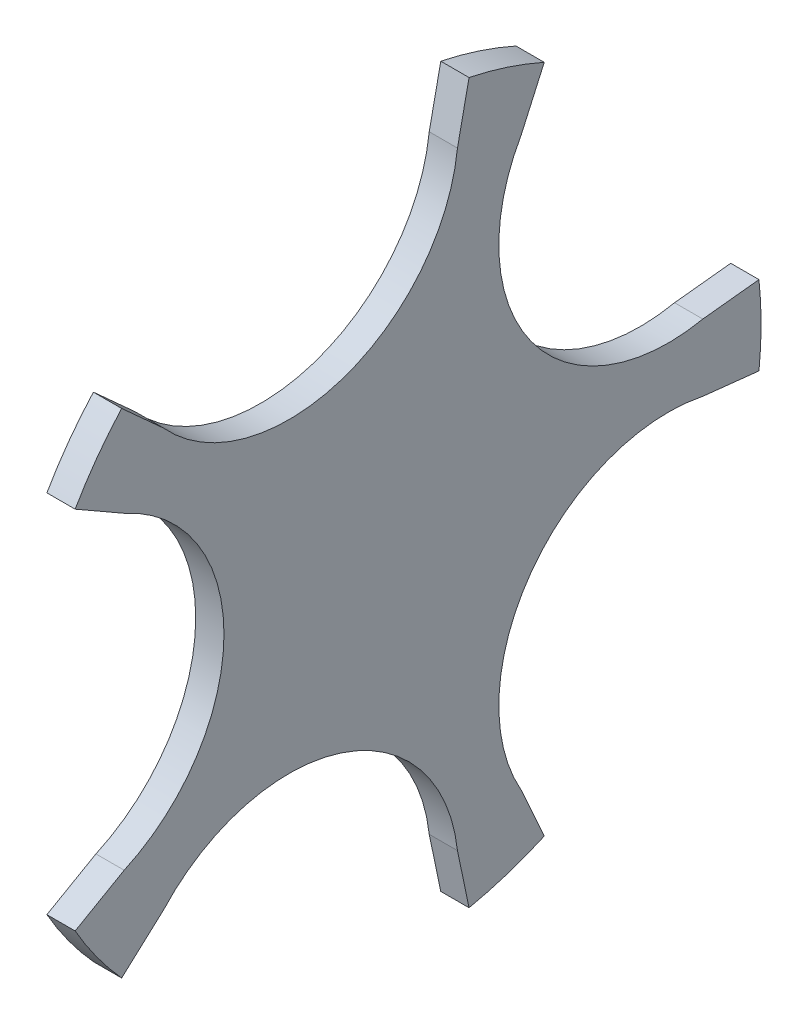
from build123d import *

# Parameters (mm, degrees)
ESTRUSIONE_ESTRUSIONE1_DEPTH = 0.5


with BuildPart() as part:
    # Schizzo1 → Estrusione-Estrusione1 (new body)
    with BuildSketch(Plane(origin=(6.153846154, 0, 0), x_dir=(0, 0, -1), z_dir=(1, 0, 0))):
        with BuildLine():
            Line((-4.816677492, -4.3645868), (-4.075796555, -3.693244539))
            ThreePointArc((-4.075796555, -3.693244539), (-0.928739601, -2.858366579), (1.126554006, -5.383590703))
            Line((1.126554006, -5.383590703), (1.331334195, -6.36219689))
            ThreePointArc((1.331334195, -6.36219689), (2.008610463, -6.181867356), (2.662533515, -5.929664011))
            Line((2.662533515, -5.929664011), (2.252993884, -5.0175882))
            ThreePointArc((2.252993884, -5.0175882), (2.431471841, -1.766567698), (5.468223352, -0.59220449))
            Line((5.468223352, -0.59220449), (6.462213701, -0.699852899))
            ThreePointArc((6.462213701, -0.699852899), (6.5, 0), (6.462213701, 0.699852899))
            Line((6.462213701, 0.699852899), (5.468223352, 0.59220449))
            ThreePointArc((5.468223352, 0.59220449), (2.431471841, 1.766567698), (2.252993884, 5.0175882))
            Line((2.252993884, 5.0175882), (2.662533515, 5.929664011))
            ThreePointArc((2.662533515, 5.929664011), (2.008610463, 6.181867356), (1.331334195, 6.36219689))
            Line((1.331334195, 6.36219689), (1.126554006, 5.383590703))
            ThreePointArc((1.126554006, 5.383590703), (-0.928739601, 2.858366579), (-4.075796555, 3.693244539))
            Line((-4.075796555, 3.693244539), (-4.816677492, 4.3645868))
            ThreePointArc((-4.816677492, 4.3645868), (-5.258610463, 3.82060414), (-5.639403919, 3.232201022))
            Line((-5.639403919, 3.232201022), (-4.771974686, 2.735037546))
            ThreePointArc((-4.771974686, 2.735037546), (-3.005464481, 0), (-4.771974686, -2.735037546))
            Line((-4.771974686, -2.735037546), (-5.639403919, -3.232201022))
            ThreePointArc((-5.639403919, -3.232201022), (-5.258610463, -3.82060414), (-4.816677492, -4.3645868))
        make_face()
    extrude(amount=-ESTRUSIONE_ESTRUSIONE1_DEPTH)


solid = part.part
